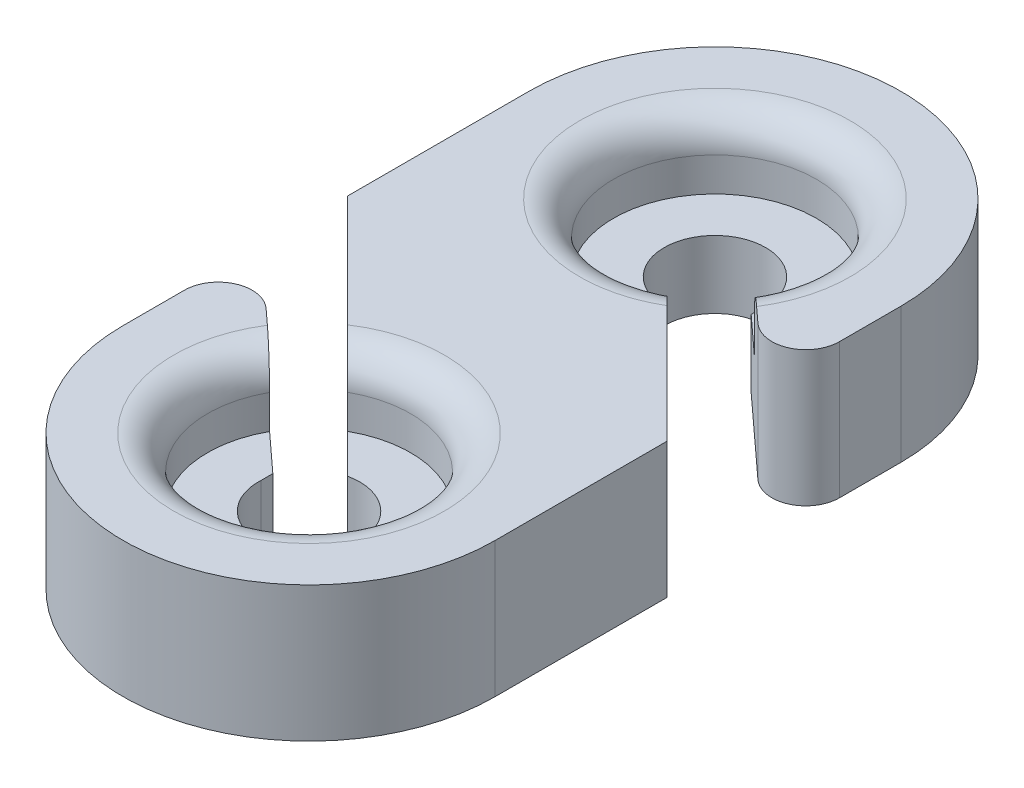
from build123d import *

# Parameters (mm, degrees)
BOSS_EXTRUDE1_DEPTH = 4
FILLET1_R           = 1
SKETCH3_R           = 3
CUT_EXTRUDE1_DEPTH  = 2
FILLET2_R           = 1


with BuildPart() as part:
    # Sketch2 → Boss-Extrude1 (new body)
    with BuildSketch(Plane(origin=(0, 0, 0), x_dir=(1, 0, 0), z_dir=(0, 1, 0))):
        with BuildLine():
            Line((-5.5, 6), (-5.5, 0.63137085))
            Line((-5.5, 0.63137085), (-0.331532497, -4.537096653))
            ThreePointArc((-0.331532497, -4.537096653), (1.145519656, -6.968392853), (-1.497676196, -5.916537366))
            Line((-1.497676196, -5.916537366), (-1.497676196, -5.572307522))
            Line((-1.497676196, -5.572307522), (-5.5, -1.914213562))
            Line((-5.5, -1.914213562), (-5.5, -6))
            ThreePointArc((-5.5, -6), (0, -11.5), (5.5, -6))
            Line((5.5, -6), (5.5, -0.914213562))
            Line((5.5, -0.914213562), (0.083462634, 4.502323804))
            ThreePointArc((0.083462634, 4.502323804), (-1.060660172, 7.060660172), (1.497676196, 5.916537366))
            Line((1.497676196, 5.916537366), (1.497676196, 5.572307522))
            Line((1.497676196, 5.572307522), (5.5, 1.914213562))
            Line((5.5, 1.914213562), (5.5, 6))
            ThreePointArc((5.5, 6), (0, 11.5), (-5.5, 6))
        make_face()
    extrude(amount=BOSS_EXTRUDE1_DEPTH)

    # Fillet1
    fillet1_edges = [part.edges().sort_by_distance(p)[0] for p in [
        (5.5, 2, -1.914213562),
        (-5.5, 2, 1.914213562),
    ]]
    fillet(fillet1_edges, radius=FILLET1_R)

    # Sketch3 → Cut-Extrude1 (cut)
    with BuildSketch(Plane(origin=(0, 4, 0), x_dir=(1, 0, 0), z_dir=(0, 1, 0))):
        with Locations((0, 6)):
            Circle(SKETCH3_R)
        with Locations((0, -6)):
            Circle(SKETCH3_R)
    extrude(amount=-CUT_EXTRUDE1_DEPTH, mode=Mode.SUBTRACT)

    # Fillet2
    fillet2_edges = [part.edges().sort_by_distance(p)[0] for p in [
        (-2.055383003, 4, -8.185269024),
        (2.130491752, 4, 8.11210911),
    ]]
    fillet(fillet2_edges, radius=FILLET2_R)


solid = part.part
